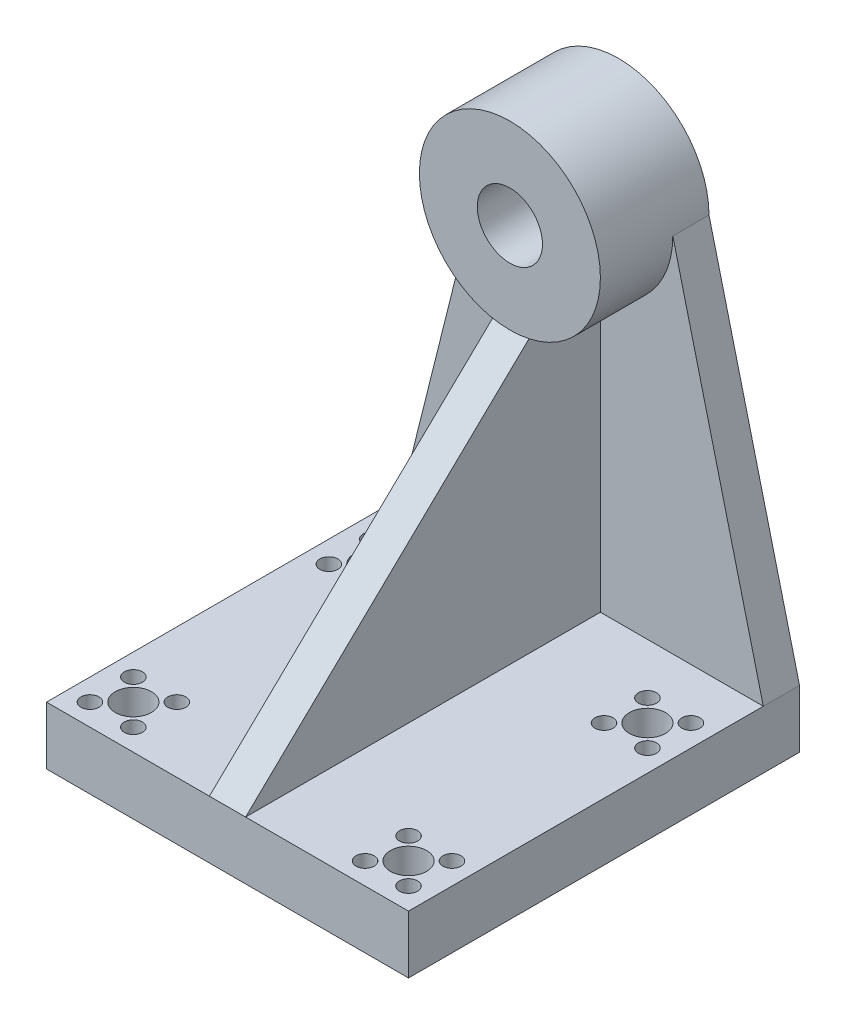
from build123d import *

# Parameters (mm, degrees)
SKETCH1_R           = 62.5
SKETCH1_R_2         = 22.5
BOSS_EXTRUDE1_DEPTH = 75
BOSS_EXTRUDE2_DEPTH = 25
SKETCH4_W           = 250
SKETCH4_H           = 270
BOSS_EXTRUDE3_DEPTH = 40
RIB5_REACH          = 417.482
SKETCH6_WALL_W      = 1103.483628374
SKETCH6_WALL_H      = 25
SKETCH9_R           = 6.25
SKETCH9_R_2         = 12.5
CUT_EXTRUDE4_DEPTH  = 40


with BuildPart() as part:
    # Sketch1 → Boss-Extrude1 (new body)
    with BuildSketch(Plane.XY):
        Circle(SKETCH1_R)
        Circle(SKETCH1_R_2, mode=Mode.SUBTRACT)
    extrude(amount=BOSS_EXTRUDE1_DEPTH)

    # Sketch3 → Boss-Extrude2 (add)
    with BuildSketch(Plane(origin=(0, 0, 0), x_dir=(-1, 0, 0), z_dir=(0, 0, -1))):
        with BuildLine():
            Line((-62.5, 0), (-125, -250))
            Line((-125, -250), (125, -250))
            Line((125, -250), (62.5, 0))
            ThreePointArc((62.5, 0), (0, -62.5), (-62.5, 0))
        make_face()
    extrude(amount=-BOSS_EXTRUDE2_DEPTH)

    # Sketch4 → Boss-Extrude3 (add)
    with BuildSketch(Plane.XZ.offset(250)):
        with Locations((0, 135)):
            Rectangle(SKETCH4_W, SKETCH4_H)
    extrude(amount=BOSS_EXTRUDE3_DEPTH)

    # Sketch6 wall → Rib5 (add, up to next)
    with BuildSketch(Plane(origin=(0, -156.25, 172.5), x_dir=(0, 0.693108716252, -0.720833064902), z_dir=(0, 0.720833064902, 0.693108716252)), mode=Mode.PRIVATE) as rib5_sk1:
        Rectangle(SKETCH6_WALL_W, SKETCH6_WALL_H)
    rib5_tool1 = extrude(rib5_sk1.sketch, amount=-RIB5_REACH, mode=Mode.PRIVATE) - part.part
    add(rib5_tool1.solids().sort_by_distance((0, -156.25, 172.5))[0])

    # Sketch9 → Cut-Extrude4 (cut)
    with BuildSketch(Plane.XZ.offset(290)):
        with Locations(Location((-110, 225, 0), (0, 0, 270))):
            Circle(SKETCH9_R)
        with Locations(Location((-110, 255, 0), (0, 0, 270))):
            Circle(SKETCH9_R)
        with Locations(Location((95, 75, 0), (0, 0, 270))):
            Circle(SKETCH9_R_2)
        with Locations(Location((-95, 240, 0), (0, 0, 270))):
            Circle(SKETCH9_R_2)
        with Locations(Location((-80, 255, 0), (0, 0, 270))):
            Circle(SKETCH9_R)
        with Locations(Location((-80, 225, 0), (0, 0, 270))):
            Circle(SKETCH9_R)
        with Locations(Location((110, 225, 0), (0, 0, 270))):
            Circle(SKETCH9_R)
        with Locations(Location((95, 240, 0), (0, 0, 270))):
            Circle(SKETCH9_R_2)
        with Locations(Location((110, 255, 0), (0, 0, 270))):
            Circle(SKETCH9_R)
        with Locations(Location((80, 255, 0), (0, 0, 270))):
            Circle(SKETCH9_R)
        with Locations(Location((80, 225, 0), (0, 0, 270))):
            Circle(SKETCH9_R)
        with Locations(Location((110, 90, 0), (0, 0, 270))):
            Circle(SKETCH9_R)
        with Locations(Location((110, 60, 0), (0, 0, 270))):
            Circle(SKETCH9_R)
        with Locations(Location((80, 60, 0), (0, 0, 270))):
            Circle(SKETCH9_R)
        with Locations(Location((80, 90, 0), (0, 0, 270))):
            Circle(SKETCH9_R)
        with Locations(Location((-80, 60, 0), (0, 0, 270))):
            Circle(SKETCH9_R)
        with Locations(Location((-80, 90, 0), (0, 0, 270))):
            Circle(SKETCH9_R)
        with Locations(Location((-110, 90, 0), (0, 0, 270))):
            Circle(SKETCH9_R)
        with Locations(Location((-110, 60, 0), (0, 0, 270))):
            Circle(SKETCH9_R)
        with Locations(Location((-95, 75, 0), (0, 0, 270))):
            Circle(SKETCH9_R_2)
    extrude(amount=-CUT_EXTRUDE4_DEPTH, mode=Mode.SUBTRACT)


solid = part.part
